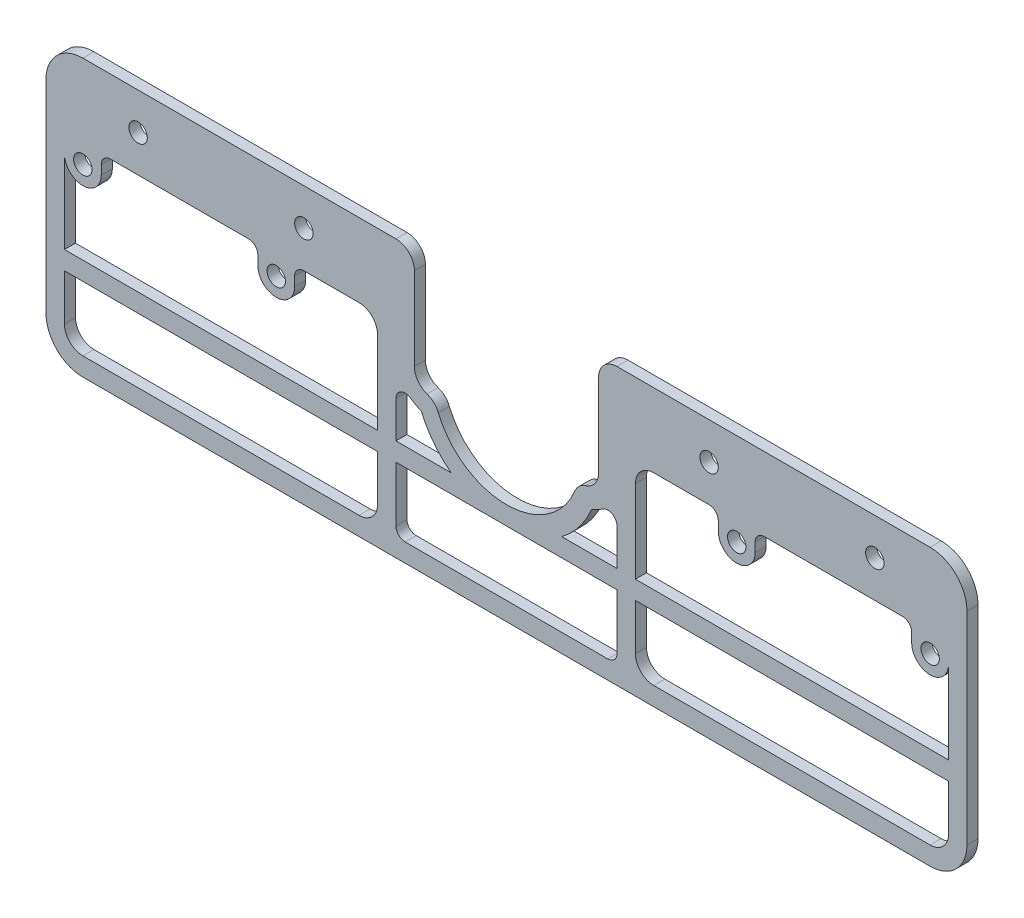
from build123d import *

# Parameters (mm, degrees)
BOSS_EXTRUDE1_DEPTH = 6
SKETCH3_R           = 5
CUT_EXTRUDE1_DEPTH  = 262.076617107
SKETCH4_R           = 5
CUT_EXTRUDE2_DEPTH  = 262.076617107
CUT_EXTRUDE5_DEPTH  = 262.076617107
FILLET5_R           = 5
FILLET6_R           = 5
SKETCH9_W           = 500
SKETCH9_H           = 10
BOSS_EXTRUDE2_DEPTH = 6


with BuildPart() as part:
    # Sketch1 → Boss-Extrude1 (new body)
    with BuildSketch(Plane.XY):
        with BuildLine():
            Line((-250, -55), (-250, 3.178280867))
            Line((-250, 3.178280867), (-250, 55))
            ThreePointArc((-250, 55), (-244.142135624, 69.142135624), (-230, 75))
            Line((-230, 75), (-220, 75))
            Line((-220, 75), (-164.330865428, 75))
            Line((-164.330865428, 75), (-60, 75))
            ThreePointArc((-60, 75), (-52.928932188, 72.071067812), (-50, 65))
            Line((-50, 65), (-50, 20))
            ThreePointArc((-50, 20), (-48.100925873, 14.1369803), (-43.125, 10.500822404))
            ThreePointArc((-43.125, 10.500822404), (-39.437786703, 8.32242004), (-37, 4.801315846))
            ThreePointArc((-37, 4.801315846), (-22.271648276, -13.226099426), (0, -20))
            Line((0, -20), (0, -40))
            Line((0, -40), (0, -65))
            Line((0, -65), (0, -75))
            Line((0, -75), (-230, -75))
            ThreePointArc((-230, -75), (-244.142135624, -69.142135624), (-250, -55))
        make_face()
    boss_extrude1 = extrude(amount=BOSS_EXTRUDE1_DEPTH)

    # Mirror1: Boss-Extrude1 across plane
    add(boss_extrude1.mirror(Plane(origin=(0, -20, 6), x_dir=(0, 0, 1), z_dir=(-1, 0, 0))))

    # Sketch3 → Cut-Extrude1 (cut, through all)
    with BuildSketch(Plane.XY.offset(6)):
        with Locations((110, 55)):
            Circle(SKETCH3_R)
        with Locations((200, 55)):
            Circle(SKETCH3_R)
        with Locations((-110, 55)):
            Circle(SKETCH3_R)
        with Locations((-200, 55)):
            Circle(SKETCH3_R)
    extrude(amount=-CUT_EXTRUDE1_DEPTH, mode=Mode.SUBTRACT)

    # Sketch4 → Cut-Extrude2 (cut, through all)
    with BuildSketch(Plane.XY.offset(6)):
        with BuildLine():
            Line((-70, -55), (-70, 25))
            ThreePointArc((-70, 25), (-72.928932188, 32.071067812), (-80, 35))
            Line((-80, 35), (-110, 35))
            ThreePointArc((-110, 35), (-113.535533906, 33.535533906), (-115, 30))
            Line((-115, 30), (-115, 25))
            ThreePointArc((-115, 25), (-115.614239502, 21.549275456), (-117.381499976, 18.522465177))
            ThreePointArc((-117.381499976, 18.522465177), (-117.5115076, 18.372596167), (-117.644462896, 18.225335882))
            ThreePointArc((-117.644462896, 18.225335882), (-122.017250069, 15.45520022), (-127.189262676, 15.242585951))
            ThreePointArc((-127.189262676, 15.242585951), (-127.232362089, 15.252356208), (-127.275417902, 15.262316838))
            ThreePointArc((-127.275417902, 15.262316838), (-131.839411289, 17.704627959), (-134.570789944, 22.101728126))
            ThreePointArc((-134.570789944, 22.101728126), (-134.892115533, 23.535059632), (-135, 25))
            Line((-135, 25), (-135, 30))
            ThreePointArc((-135, 30), (-136.464466094, 33.535533906), (-140, 35))
            Line((-140, 35), (-215, 35))
            ThreePointArc((-215, 35), (-218.535533906, 33.535533906), (-220, 30))
            Line((-220, 30), (-220, 25))
            ThreePointArc((-220, 25), (-220.586588267, 21.625436392), (-222.277535909, 18.646768667))
            ThreePointArc((-222.277535909, 18.646768667), (-226.488765584, 15.636708224), (-231.640827685, 15.135534251))
            ThreePointArc((-231.640827685, 15.135534251), (-237.629163678, 18.535028107), (-240, 25))
            Line((-240, 25), (-240, -55))
            ThreePointArc((-240, -55), (-237.071067812, -62.071067812), (-230, -65))
            Line((-230, -65), (-210, -65))
            Line((-210, -65), (-190, -65))
            Line((-190, -65), (-110, -65))
            Line((-110, -65), (-90, -65))
            Line((-90, -65), (-80, -65))
            ThreePointArc((-80, -65), (-72.928932188, -62.071067812), (-70, -55))
        make_face()
        with Locations((-230, 25)):
            Circle(SKETCH4_R)
        with Locations((-125, 25)):
            Circle(SKETCH4_R)
    cut_extrude2 = extrude(amount=-CUT_EXTRUDE2_DEPTH, mode=Mode.SUBTRACT)

    # Sketch8 → Cut-Extrude5 (cut, through all)
    with BuildSketch(Plane.XY.offset(6)):
        with BuildLine():
            Line((-60, 0), (-60, -65))
            Line((-60, -65), (60, -65))
            Line((60, -65), (60, 0))
            ThreePointArc((60, 0), (57.236067977, 4.472135955), (52, 4))
            ThreePointArc((52, 4), (49.247332505, 2.266223145), (46.25, 1.001644808))
            ThreePointArc((46.25, 1.001644808), (0, -30), (-46.25, 1.001644808))
            ThreePointArc((-46.25, 1.001644808), (-49.247332505, 2.266223145), (-52, 4))
            ThreePointArc((-52, 4), (-57.236067977, 4.472135955), (-60, 0))
        make_face()
    extrude(amount=-CUT_EXTRUDE5_DEPTH, mode=Mode.SUBTRACT)

    # Fillet5
    fillet5_edges = [part.edges().sort_by_distance(p)[0] for p in [
        (-60, -65, 3),
    ]]
    fillet(fillet5_edges, radius=FILLET5_R)

    # Fillet6
    fillet6_edges = [part.edges().sort_by_distance(p)[0] for p in [
        (60, -65, 3),
    ]]
    fillet(fillet6_edges, radius=FILLET6_R)

    # Mirror2: Cut-Extrude2 across plane
    add(cut_extrude2.mirror(Plane(origin=(0, 0, 0), x_dir=(0, 0, 1), z_dir=(1, 0, 0))), mode=Mode.SUBTRACT)

    # Sketch9 → Boss-Extrude2 (add)
    with BuildSketch(Plane.XY.offset(6)):
        with Locations((0, -25)):
            Rectangle(SKETCH9_W, SKETCH9_H)
    extrude(amount=-BOSS_EXTRUDE2_DEPTH)


solid = part.part
